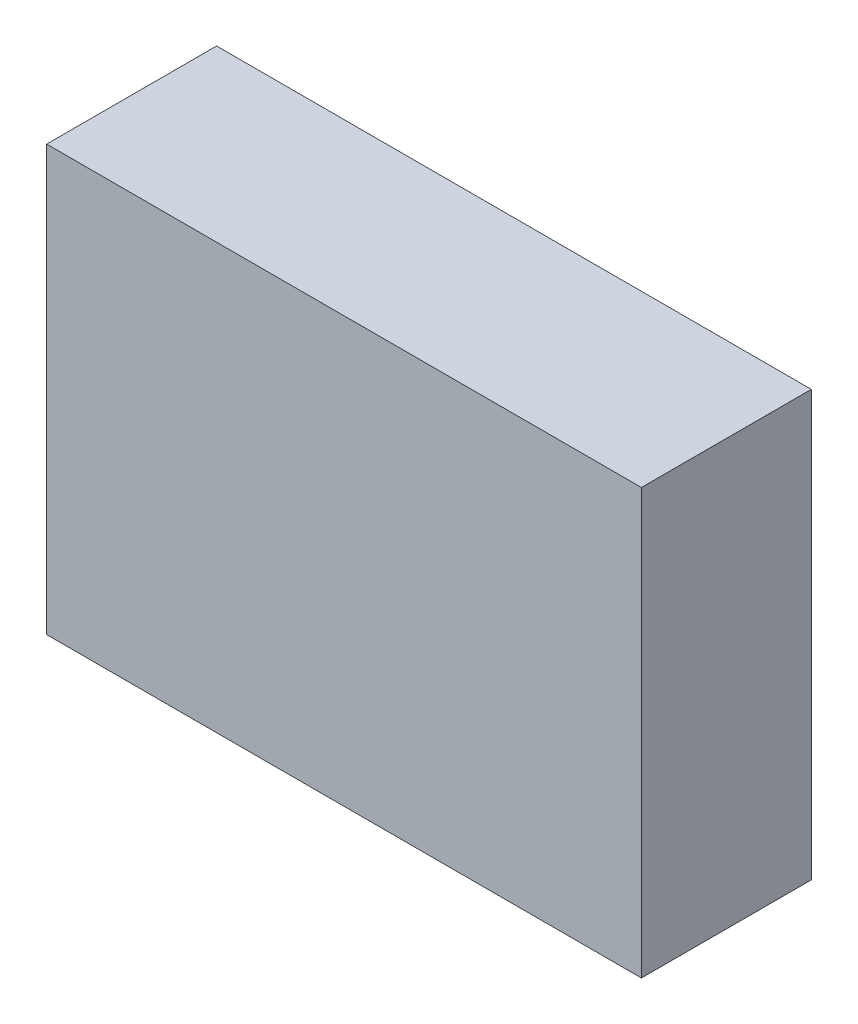
from build123d import *

# Parameters (mm, degrees)
SKETCH2_W           = 7
SKETCH2_H           = 5
BOSS_EXTRUDE1_DEPTH = 2
SKETCH3_W           = 6.5
SKETCH3_H           = 1.5
CUT_EXTRUDE1_DEPTH  = 0.5


with BuildPart() as part:
    # Sketch2 → Boss-Extrude1 (new body)
    with BuildSketch(Plane.XY):
        with Locations((0, 0.3508563)):
            Rectangle(SKETCH2_W, SKETCH2_H)
    extrude(amount=BOSS_EXTRUDE1_DEPTH)

    # Sketch3 → Cut-Extrude1 (cut)
    with BuildSketch(Plane.XZ.offset(2.1491437)):
        with Locations((0, 1)):
            Rectangle(SKETCH3_W, SKETCH3_H)
    extrude(amount=-CUT_EXTRUDE1_DEPTH, mode=Mode.SUBTRACT)


solid = part.part
